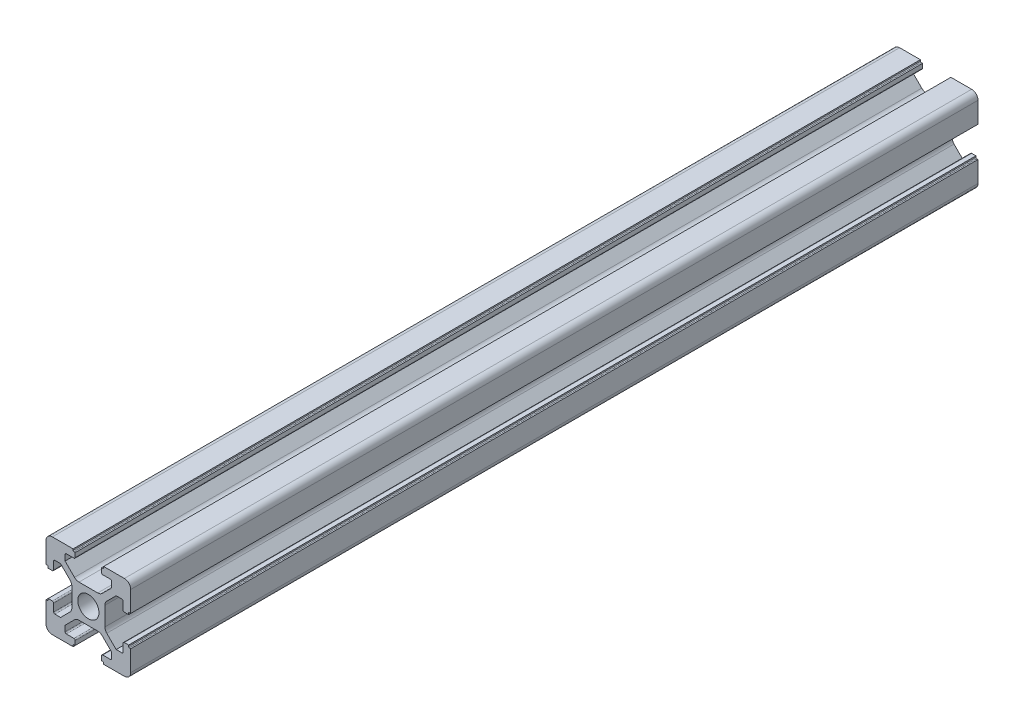
from build123d import *

# Parameters (mm, degrees)
SKETCH_1_R      = 2.5
EXTRUDE_1_DEPTH = 200


with BuildPart() as part:
    # 草图1 → 凸台-拉伸1 (new body)
    with BuildSketch(Plane.XY):
        with BuildLine():
            Line((4.215995631, 3.244230202), (6.436655803, 5.464890373))
            Line((6.436655803, 5.464890373), (7.776655803, 5.464890373))
            ThreePointArc((7.776655803, 5.464890373), (7.988787838, 5.377022408), (8.076655803, 5.164890373))
            Line((8.076655803, 5.164890373), (8.076655803, 3.364890373))
            ThreePointArc((8.076655803, 3.364890373), (8.164523769, 3.152758339), (8.376655803, 3.064890373))
            Line((8.376655803, 3.064890373), (9.376655803, 3.064890373))
            Line((9.376655803, 3.064890373), (9.376655803, 3.364890373))
            ThreePointArc((9.376655803, 3.364890373), (9.435234447, 3.50631173), (9.576655803, 3.564890373))
            Line((9.576655803, 3.564890373), (9.876655803, 3.564890373))
            Line((9.876655803, 3.564890373), (9.876655803, 8.464890373))
            ThreePointArc((9.876655803, 8.464890373), (9.437315975, 9.525550545), (8.376655803, 9.964890373))
            Line((8.376655803, 9.964890373), (3.476655803, 9.964890373))
            Line((3.476655803, 9.964890373), (3.476655803, 9.664890373))
            ThreePointArc((3.476655803, 9.664890373), (3.418077159, 9.523469017), (3.276655803, 9.464890373))
            Line((3.276655803, 9.464890373), (2.976655803, 9.464890373))
            Line((2.976655803, 9.464890373), (2.976655803, 8.464890373))
            ThreePointArc((2.976655803, 8.464890373), (3.064523769, 8.252758339), (3.276655803, 8.164890373))
            Line((3.276655803, 8.164890373), (5.076655803, 8.164890373))
            ThreePointArc((5.076655803, 8.164890373), (5.288787838, 8.077022408), (5.376655803, 7.864890373))
            Line((5.376655803, 7.864890373), (5.376655803, 6.524890373))
            Line((5.376655803, 6.524890373), (3.155995631, 4.304230202))
            ThreePointArc((3.155995631, 4.304230202), (2.669360608, 3.979071075), (2.09533546, 3.864890373))
            Line((2.09533546, 3.864890373), (-2.342023853, 3.864890373))
            ThreePointArc((-2.342023853, 3.864890373), (-2.916049002, 3.979071075), (-3.402684025, 4.304230202))
            Line((-3.402684025, 4.304230202), (-5.623344197, 6.524890373))
            Line((-5.623344197, 6.524890373), (-5.623344197, 7.864890373))
            ThreePointArc((-5.623344197, 7.864890373), (-5.535476231, 8.077022408), (-5.323344197, 8.164890373))
            Line((-5.323344197, 8.164890373), (-3.523344197, 8.164890373))
            ThreePointArc((-3.523344197, 8.164890373), (-3.311212162, 8.252758339), (-3.223344197, 8.464890373))
            Line((-3.223344197, 8.464890373), (-3.223344197, 9.464890373))
            Line((-3.223344197, 9.464890373), (-3.523344197, 9.464890373))
            ThreePointArc((-3.523344197, 9.464890373), (-3.664765553, 9.523469017), (-3.723344197, 9.664890373))
            Line((-3.723344197, 9.664890373), (-3.723344197, 9.964890373))
            Line((-3.723344197, 9.964890373), (-8.623344197, 9.964890373))
            ThreePointArc((-8.623344197, 9.964890373), (-9.684004369, 9.525550545), (-10.123344197, 8.464890373))
            Line((-10.123344197, 8.464890373), (-10.123344197, 3.564890373))
            Line((-10.123344197, 3.564890373), (-9.823344197, 3.564890373))
            ThreePointArc((-9.823344197, 3.564890373), (-9.681922841, 3.50631173), (-9.623344197, 3.364890373))
            Line((-9.623344197, 3.364890373), (-9.623344197, 3.064890373))
            Line((-9.623344197, 3.064890373), (-8.623344197, 3.064890373))
            ThreePointArc((-8.623344197, 3.064890373), (-8.411212162, 3.152758339), (-8.323344197, 3.364890373))
            Line((-8.323344197, 3.364890373), (-8.323344197, 5.164890373))
            ThreePointArc((-8.323344197, 5.164890373), (-8.235476231, 5.377022408), (-8.023344197, 5.464890373))
            Line((-8.023344197, 5.464890373), (-6.683344197, 5.464890373))
            Line((-6.683344197, 5.464890373), (-4.462684025, 3.244230202))
            ThreePointArc((-4.462684025, 3.244230202), (-4.137524898, 2.757595178), (-4.023344197, 2.18357003))
            Line((-4.023344197, 2.18357003), (-4.023344197, -2.253789283))
            ThreePointArc((-4.023344197, -2.253789283), (-4.137524898, -2.827814432), (-4.462684025, -3.314449455))
            Line((-4.462684025, -3.314449455), (-6.683344197, -5.535109627))
            Line((-6.683344197, -5.535109627), (-8.023344197, -5.535109627))
            ThreePointArc((-8.023344197, -5.535109627), (-8.235476231, -5.447241661), (-8.323344197, -5.235109627))
            Line((-8.323344197, -5.235109627), (-8.323344197, -3.435109627))
            ThreePointArc((-8.323344197, -3.435109627), (-8.411212162, -3.222977592), (-8.623344197, -3.135109627))
            Line((-8.623344197, -3.135109627), (-9.623344197, -3.135109627))
            Line((-9.623344197, -3.135109627), (-9.623344197, -3.435109627))
            ThreePointArc((-9.623344197, -3.435109627), (-9.681922841, -3.576530983), (-9.823344197, -3.635109627))
            Line((-9.823344197, -3.635109627), (-10.123344197, -3.635109627))
            Line((-10.123344197, -3.635109627), (-10.123344197, -8.535109627))
            ThreePointArc((-10.123344197, -8.535109627), (-9.684004369, -9.595769798), (-8.623344197, -10.035109627))
            Line((-8.623344197, -10.035109627), (-3.723344197, -10.035109627))
            Line((-3.723344197, -10.035109627), (-3.723344197, -9.735109627))
            ThreePointArc((-3.723344197, -9.735109627), (-3.664765553, -9.59368827), (-3.523344197, -9.535109627))
            Line((-3.523344197, -9.535109627), (-3.223344197, -9.535109627))
            Line((-3.223344197, -9.535109627), (-3.223344197, -8.535109627))
            ThreePointArc((-3.223344197, -8.535109627), (-3.311212162, -8.322977592), (-3.523344197, -8.235109627))
            Line((-3.523344197, -8.235109627), (-5.323344197, -8.235109627))
            ThreePointArc((-5.323344197, -8.235109627), (-5.535476231, -8.147241661), (-5.623344197, -7.935109627))
            Line((-5.623344197, -7.935109627), (-5.623344197, -6.595109627))
            Line((-5.623344197, -6.595109627), (-3.402684025, -4.374449455))
            ThreePointArc((-3.402684025, -4.374449455), (-2.916049002, -4.049290328), (-2.342023853, -3.935109627))
            Line((-2.342023853, -3.935109627), (2.09533546, -3.935109627))
            ThreePointArc((2.09533546, -3.935109627), (2.669360608, -4.049290328), (3.155995631, -4.374449455))
            Line((3.155995631, -4.374449455), (5.376655803, -6.595109627))
            Line((5.376655803, -6.595109627), (5.376655803, -7.935109627))
            ThreePointArc((5.376655803, -7.935109627), (5.288787838, -8.147241661), (5.076655803, -8.235109627))
            Line((5.076655803, -8.235109627), (3.276655803, -8.235109627))
            ThreePointArc((3.276655803, -8.235109627), (3.064523769, -8.322977592), (2.976655803, -8.535109627))
            Line((2.976655803, -8.535109627), (2.976655803, -9.535109627))
            Line((2.976655803, -9.535109627), (3.276655803, -9.535109627))
            ThreePointArc((3.276655803, -9.535109627), (3.418077159, -9.59368827), (3.476655803, -9.735109627))
            Line((3.476655803, -9.735109627), (3.476655803, -10.035109627))
            Line((3.476655803, -10.035109627), (8.376655803, -10.035109627))
            ThreePointArc((8.376655803, -10.035109627), (9.437315975, -9.595769798), (9.876655803, -8.535109627))
            Line((9.876655803, -8.535109627), (9.876655803, -3.635109627))
            Line((9.876655803, -3.635109627), (9.576655803, -3.635109627))
            ThreePointArc((9.576655803, -3.635109627), (9.435234447, -3.576530983), (9.376655803, -3.435109627))
            Line((9.376655803, -3.435109627), (9.376655803, -3.135109627))
            Line((9.376655803, -3.135109627), (8.376655803, -3.135109627))
            ThreePointArc((8.376655803, -3.135109627), (8.164523769, -3.222977592), (8.076655803, -3.435109627))
            Line((8.076655803, -3.435109627), (8.076655803, -5.235109627))
            ThreePointArc((8.076655803, -5.235109627), (7.988787838, -5.447241661), (7.776655803, -5.535109627))
            Line((7.776655803, -5.535109627), (6.436655803, -5.535109627))
            Line((6.436655803, -5.535109627), (4.215995631, -3.314449455))
            ThreePointArc((4.215995631, -3.314449455), (3.890836504, -2.827814432), (3.776655803, -2.253789283))
            Line((3.776655803, -2.253789283), (3.776655803, 2.18357003))
            ThreePointArc((3.776655803, 2.18357003), (3.890836504, 2.757595178), (4.215995631, 3.244230202))
        make_face()
        with Locations((-0.123344197, -0.035109627)):
            Circle(SKETCH_1_R, mode=Mode.SUBTRACT)
    extrude(amount=EXTRUDE_1_DEPTH)


solid = part.part
